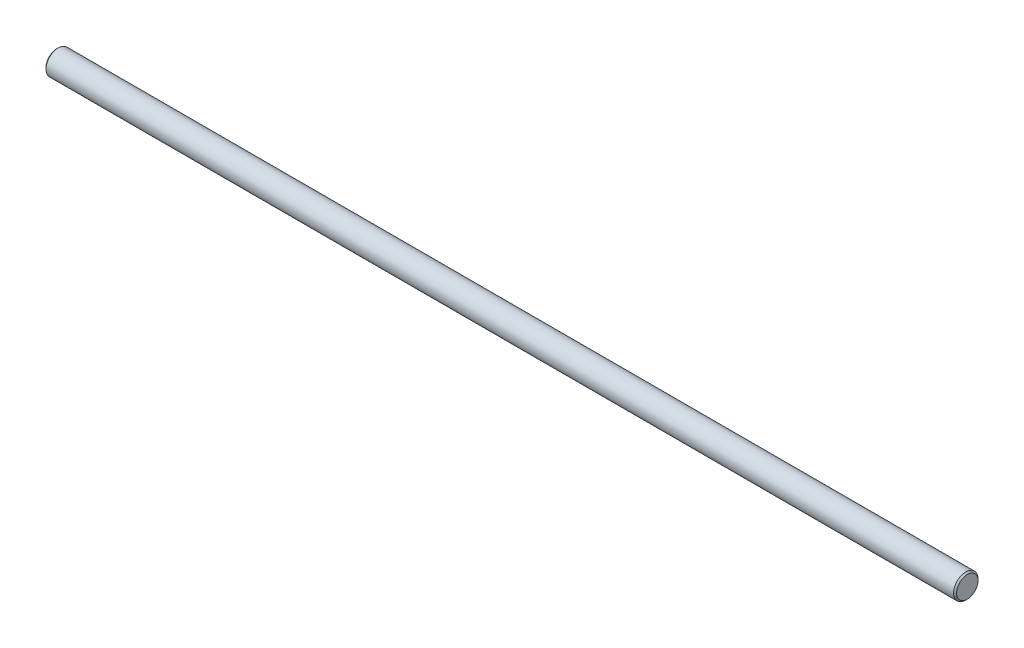
from build123d import *

# Parameters (mm, degrees)
CROQUIS1_R              = 4
SALIENTE_EXTRUIR1_DEPTH = 297.9
CHAFL_N1_SIZE           = 0.5


with BuildPart() as part:
    # Croquis1 → Saliente-Extruir1 (new body)
    with BuildSketch(Plane(origin=(397.215189324, 0, 0), x_dir=(0, 0, -1), z_dir=(1, 0, 0))):
        with Locations(Location((160.280625692, -23.237281075, 0), (0, 0, 90))):
            Circle(CROQUIS1_R)
    extrude(amount=-SALIENTE_EXTRUIR1_DEPTH)

    # Chaflán1
    chafl_n1_edges = [part.edges().sort_by_distance(p)[0] for p in [
        (397.215189324, -27.237281075, -160.280625692),
        (99.315189324, -27.237281075, -160.280625692),
    ]]
    chamfer(chafl_n1_edges, length=CHAFL_N1_SIZE)


solid = part.part
